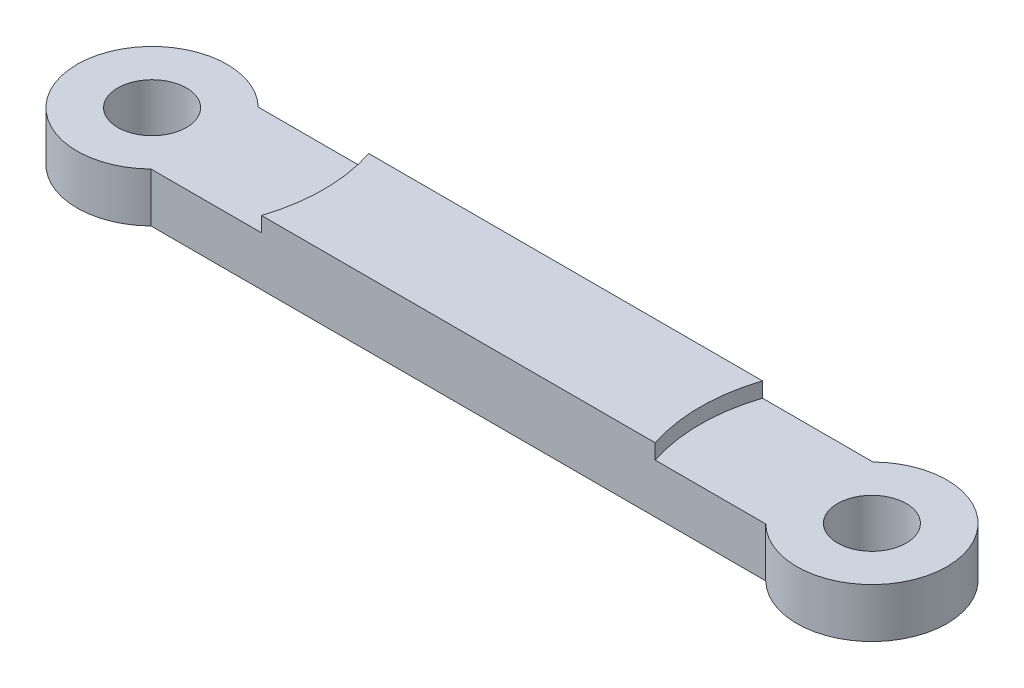
from build123d import *

# Parameters (mm, degrees)
SKETCH1_R           = 1.5
BOSS_EXTRUDE1_DEPTH = 3
SKETCH2_R           = 8
CUT_EXTRUDE1_DEPTH  = 0.7
SKETCH3_R           = 1.6
CUT_EXTRUDE3_DEPTH  = 10.5


with BuildPart() as part:
    # Sketch1 → Boss-Extrude1 (new body)
    with BuildSketch(Plane(origin=(0, 0, 0), x_dir=(1, 0, 0), z_dir=(0, 1, 0))):
        with BuildLine():
            Line((-14.325510257, -2.5), (14.325510257, -2.5))
            ThreePointArc((14.325510257, -2.5), (20.275, 0), (14.325510257, 2.5))
            Line((14.325510257, 2.5), (-14.325510257, 2.5))
            ThreePointArc((-14.325510257, 2.5), (-20.275, 0), (-14.325510257, -2.5))
        make_face()
        with Locations(Location((16.775, 0, 0), (0, 0, 270))):
            Circle(SKETCH1_R, mode=Mode.SUBTRACT)
        with Locations(Location((-16.775, 0, 0), (0, 0, 270))):
            Circle(SKETCH1_R, mode=Mode.SUBTRACT)
    extrude(amount=BOSS_EXTRUDE1_DEPTH)

    # Sketch2 → Cut-Extrude1 (cut)
    with BuildSketch(Plane(origin=(0, 3, 0), x_dir=(1, 0, 0), z_dir=(0, 1, 0))):
        with Locations((-16.775, 0)):
            Circle(SKETCH2_R)
        with Locations((16.775, 0)):
            Circle(SKETCH2_R)
    extrude(amount=-CUT_EXTRUDE1_DEPTH, mode=Mode.SUBTRACT)

    # Sketch3 → Cut-Extrude3 (cut)
    with BuildSketch(Plane(origin=(0, 2.3, 0), x_dir=(1, 0, 0), z_dir=(0, 1, 0))):
        with Locations(Location((-16.775, 0, 0), (0, 0, 270))):
            Circle(SKETCH3_R)
        with Locations(Location((16.775, 0, 0), (0, 0, 270))):
            Circle(SKETCH3_R)
    extrude(amount=-CUT_EXTRUDE3_DEPTH, mode=Mode.SUBTRACT)


solid = part.part
